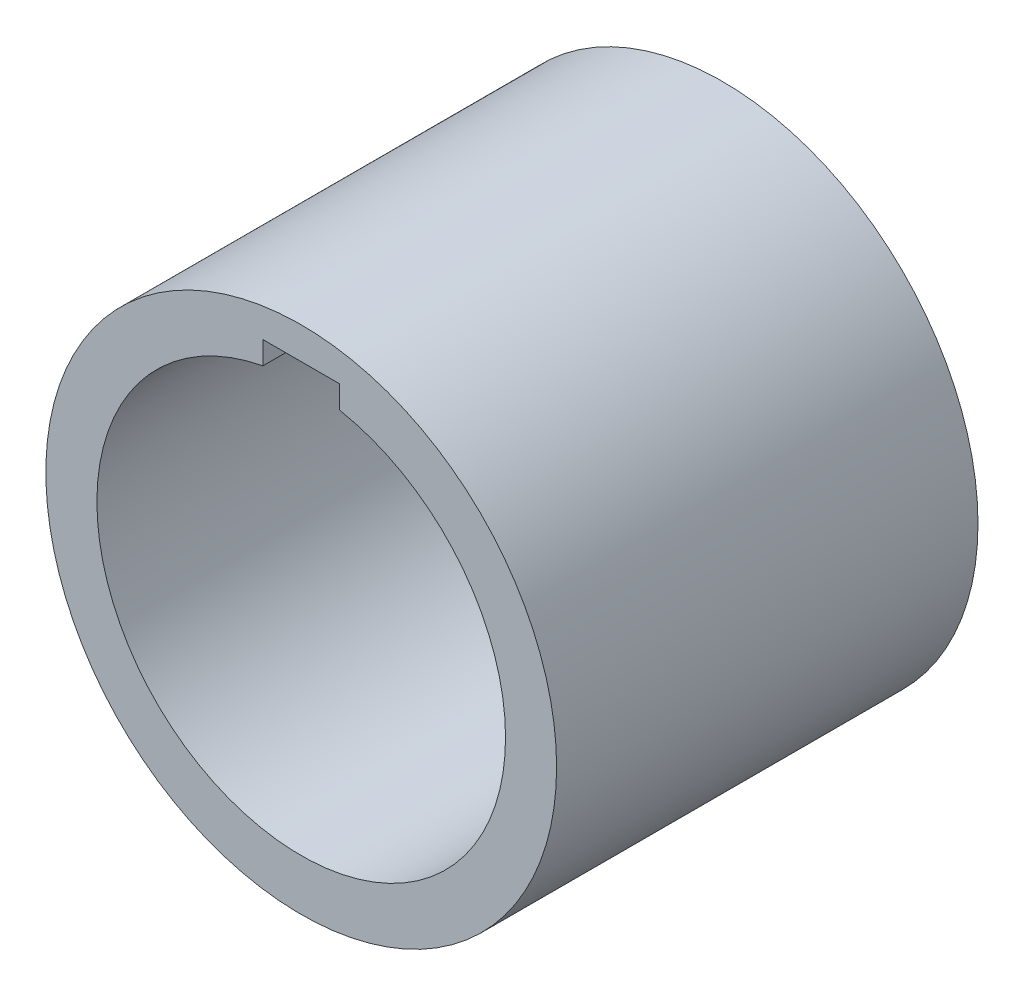
from build123d import *

# Parameters (mm, degrees)
CROQUIS1_R              = 10
SALIENTE_EXTRUIR1_DEPTH = 1.5
CROQUIS2_R              = 10
CROQUIS2_R_2            = 8
SALIENTE_EXTRUIR2_DEPTH = 15
CORTAR_EXTRUIR2_REACH   = 22.616
CROQUIS4_R              = 0.95
CROQUIS5_W              = 3
CROQUIS5_H              = 1.5
CORTAR_EXTRUIR3_DEPTH   = 15
CROQUIS6_R              = 3
CROQUIS6_R_2            = 1.45
SALIENTE_EXTRUIR3_DEPTH = 2


with BuildPart() as part:
    # Croquis1 → Saliente-Extruir1 (new body)
    with BuildSketch(Plane.XY):
        Circle(CROQUIS1_R)
    extrude(amount=SALIENTE_EXTRUIR1_DEPTH)

    # Croquis2 → Saliente-Extruir2 (add)
    with BuildSketch(Plane.XY.offset(1.5)):
        Circle(CROQUIS2_R)
        Circle(CROQUIS2_R_2, mode=Mode.SUBTRACT)
    extrude(amount=SALIENTE_EXTRUIR2_DEPTH)

    # Croquis4 → Cortar-Extruir2 (cut, up to next)
    with BuildSketch(Plane.XY.offset(1.5), mode=Mode.PRIVATE) as cortar_extruir2_sk1:
        with Locations((-5.999300536, -0.09161372)):
            Circle(CROQUIS4_R)
    cortar_extruir2_tool1 = extrude(cortar_extruir2_sk1.sketch, amount=-CORTAR_EXTRUIR2_REACH, mode=Mode.PRIVATE) & part.part
    # Croquis4 → Cortar-Extruir2 (cut, up to next)
    with BuildSketch(Plane.XY.offset(1.5), mode=Mode.PRIVATE) as cortar_extruir2_sk2:
        with Locations((-0.09161372, 5.999300536)):
            Circle(CROQUIS4_R)
    cortar_extruir2_tool2 = extrude(cortar_extruir2_sk2.sketch, amount=-CORTAR_EXTRUIR2_REACH, mode=Mode.PRIVATE) & part.part
    # Croquis4 → Cortar-Extruir2 (cut, up to next)
    with BuildSketch(Plane.XY.offset(1.5), mode=Mode.PRIVATE) as cortar_extruir2_sk3:
        with Locations((5.999300536, 0.09161372)):
            Circle(CROQUIS4_R)
    cortar_extruir2_tool3 = extrude(cortar_extruir2_sk3.sketch, amount=-CORTAR_EXTRUIR2_REACH, mode=Mode.PRIVATE) & part.part
    # Croquis4 → Cortar-Extruir2 (cut, up to next)
    with BuildSketch(Plane.XY.offset(1.5), mode=Mode.PRIVATE) as cortar_extruir2_sk4:
        with Locations((0.09161372, -5.999300536)):
            Circle(CROQUIS4_R)
    cortar_extruir2_tool4 = extrude(cortar_extruir2_sk4.sketch, amount=-CORTAR_EXTRUIR2_REACH, mode=Mode.PRIVATE) & part.part
    add(cortar_extruir2_tool1.solids().sort_by_distance((-5.999301, -0.091614, 1.5))[0], mode=Mode.SUBTRACT)
    add(cortar_extruir2_tool2.solids().sort_by_distance((-0.091614, 5.999301, 1.5))[0], mode=Mode.SUBTRACT)
    add(cortar_extruir2_tool3.solids().sort_by_distance((5.999301, 0.091614, 1.5))[0], mode=Mode.SUBTRACT)
    add(cortar_extruir2_tool4.solids().sort_by_distance((0.091614, -5.999301, 1.5))[0], mode=Mode.SUBTRACT)

    # Croquis5 → Cortar-Extruir3 (cut)
    with BuildSketch(Plane.XY.offset(16.5)):
        with Locations((0, 8)):
            Rectangle(CROQUIS5_W, CROQUIS5_H)
    extrude(amount=-CORTAR_EXTRUIR3_DEPTH, mode=Mode.SUBTRACT)

    # Croquis6 → Saliente-Extruir3 (add)
    with BuildSketch(Plane.XY.offset(1.5)):
        with BuildLine():
            Line((1.5, 7.858116823), (1.5, 8.75))
            Line((1.5, 8.75), (-1.5, 8.75))
            Line((-1.5, 8.75), (-1.5, 7.858116823))
            ThreePointArc((-1.5, 7.858116823), (0, -8), (1.5, 7.858116823))
        make_face()
        Circle(CROQUIS6_R, mode=Mode.SUBTRACT)
        with Locations((-0.09161372, 5.999300536)):
            Circle(CROQUIS6_R_2, mode=Mode.SUBTRACT)
        with Locations((5.999300536, 0.09161372)):
            Circle(CROQUIS6_R_2, mode=Mode.SUBTRACT)
        with Locations((-5.999300536, -0.09161372)):
            Circle(CROQUIS6_R_2, mode=Mode.SUBTRACT)
        with Locations((0.09161372, -5.999300536)):
            Circle(CROQUIS6_R_2, mode=Mode.SUBTRACT)
    extrude(amount=SALIENTE_EXTRUIR3_DEPTH)


solid = part.part
